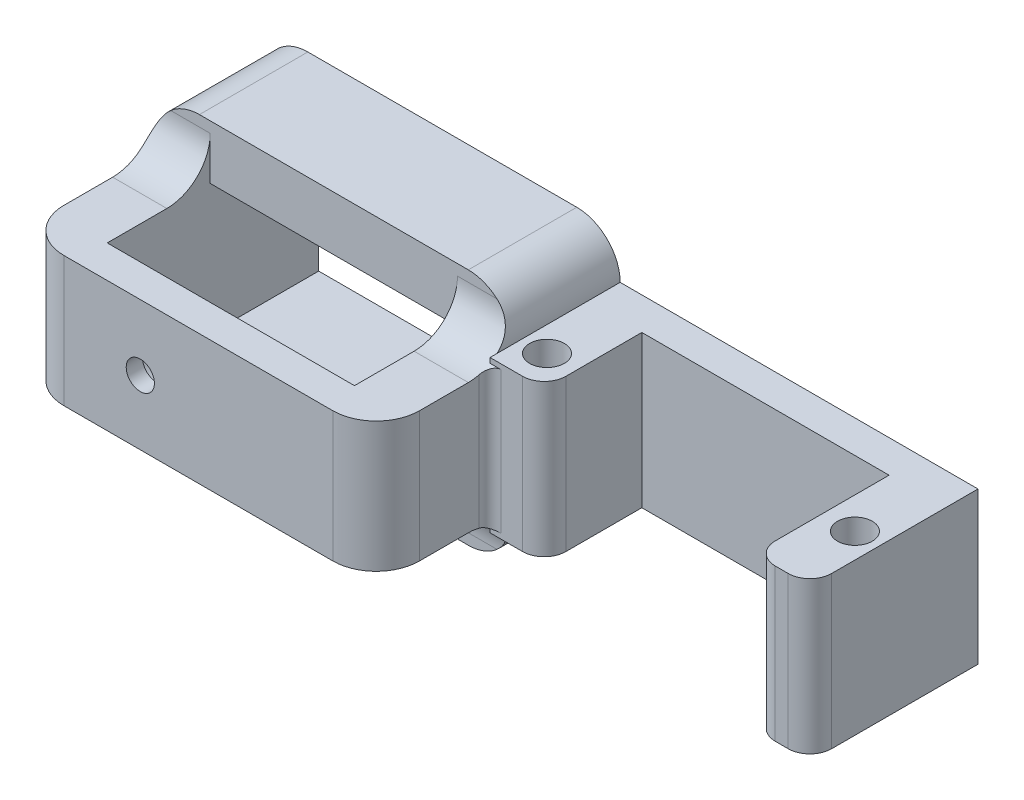
from build123d import *

# Parameters (mm, degrees)
EXTRUDE_THIN1_DEPTH = 10
FILLET1_R           = 4
SKETCH2_W           = 5
SKETCH2_H           = 12
BOSS_EXTRUDE1_DEPTH = 9.5
SKETCH3_W           = 32.8
SKETCH3_H           = 12
BOSS_EXTRUDE2_DEPTH = 3
FILLET2_R           = 4
SKETCH4_R           = 1.3
CUT_EXTRUDE1_DEPTH  = 3
SKETCH5_R           = 1.5
CUT_EXTRUDE2_DEPTH  = 6
SKETCH6_W           = 32.8
SKETCH6_H           = 10
BOSS_EXTRUDE3_DEPTH = 5
FILLET3_R           = 4
FILLET4_R           = 4
SKETCH7_R           = 2.75
CUT_EXTRUDE3_DEPTH  = 1.5
SKETCH9_W           = 9
SKETCH9_H           = 14
BOSS_EXTRUDE5_DEPTH = 5
FILLET10_R          = 1
SKETCH12_W          = 33
SKETCH12_H          = 14
BOSS_EXTRUDE7_DEPTH = 3
SKETCH13_W          = 5.2
SKETCH13_H          = 14
BOSS_EXTRUDE8_DEPTH = 12.5
FILLET11_R          = 2
FILLET13_R          = 2
SKETCH14_R          = 1.6
CUT_EXTRUDE4_DEPTH  = 58.189247273


with BuildPart() as part:
    # Sketch1 → Extrude-Thin1 (new body)
    with BuildSketch(Plane.XY):
        Polygon((-11.4, -12), (-11.4, 0), (11.4, 0), (11.4, -12), (16.4, -12), (16.4, 5), (-16.4, 5), (-16.4, -12), align=None)
    extrude(amount=EXTRUDE_THIN1_DEPTH)

    # Fillet1
    fillet1_edges = [part.edges().sort_by_distance(p)[0] for p in [
        (-16.4, 5, 5),
        (16.4, 5, 5),
    ]]
    fillet(fillet1_edges, radius=FILLET1_R)

    # Sketch2 → Boss-Extrude1 (add)
    with BuildSketch(Plane.XY.offset(10)):
        with Locations((-13.9, -6)):
            Rectangle(SKETCH2_W, SKETCH2_H)
        with Locations((13.9, -6)):
            Rectangle(SKETCH2_W, SKETCH2_H)
    extrude(amount=BOSS_EXTRUDE1_DEPTH)

    # Sketch3 → Boss-Extrude2 (add)
    with BuildSketch(Plane.XY.offset(19.5)):
        with Locations((0, -6)):
            Rectangle(SKETCH3_W, SKETCH3_H)
    extrude(amount=BOSS_EXTRUDE2_DEPTH)

    # Fillet2
    fillet2_edges = [part.edges().sort_by_distance(p)[0] for p in [
        (13.9, 0, 10),
        (-13.9, 0, 10),
        (16.4, -6, 22.5),
        (-16.4, -6, 22.5),
    ]]
    fillet(fillet2_edges, radius=FILLET2_R)

    # Sketch4 → Cut-Extrude1 (cut)
    with BuildSketch(Plane(origin=(0, 0, 19.5), x_dir=(-1, 0, 0), z_dir=(0, 0, -1))):
        with Locations((5.35, -6.05)):
            Circle(SKETCH4_R)
    extrude(amount=-CUT_EXTRUDE1_DEPTH, mode=Mode.SUBTRACT)

    # Sketch5 → Cut-Extrude2 (cut)
    with BuildSketch(Plane(origin=(0, 0, 0), x_dir=(-1, 0, 0), z_dir=(0, 0, -1))):
        with Locations((14.3, -6.05)):
            Circle(SKETCH5_R)
        with Locations((-14.1, -6.05)):
            Circle(SKETCH5_R)
    extrude(amount=-CUT_EXTRUDE2_DEPTH, mode=Mode.SUBTRACT)

    # Sketch6 → Boss-Extrude3 (add)
    with BuildSketch(Plane.XZ.offset(12)):
        with Locations((0, 5)):
            Rectangle(SKETCH6_W, SKETCH6_H)
    extrude(amount=BOSS_EXTRUDE3_DEPTH)

    # Fillet3
    fillet3_edges = [part.edges().sort_by_distance(p)[0] for p in [
        (16.4, -17, 5),
        (-16.4, -17, 5),
    ]]
    fillet(fillet3_edges, radius=FILLET3_R)

    # Fillet4
    fillet4_edges = [part.edges().sort_by_distance(p)[0] for p in [
        (13.9, -12, 10),
        (-13.9, -12, 10),
    ]]
    fillet(fillet4_edges, radius=FILLET4_R)

    # Sketch7 → Cut-Extrude3 (cut)
    with BuildSketch(Plane(origin=(0, 0, 19.5), x_dir=(-1, 0, 0), z_dir=(0, 0, -1))):
        with Locations((5.35, -6.05)):
            Circle(SKETCH7_R)
    extrude(amount=-CUT_EXTRUDE3_DEPTH, mode=Mode.SUBTRACT)

    # Sketch9 → Boss-Extrude5 (add)
    with BuildSketch(Plane(origin=(16.4, 0, 0), x_dir=(0, 0, -1), z_dir=(1, 0, 0))):
        with Locations((-7.5, -6)):
            Rectangle(SKETCH9_W, SKETCH9_H)
    extrude(amount=BOSS_EXTRUDE5_DEPTH)

    # Fillet10
    fillet10_edges = [part.edges().sort_by_distance(p)[0] for p in [
        (16.4, -6, 12),
    ]]
    fillet(fillet10_edges, radius=FILLET10_R)

    # Sketch12 → Boss-Extrude7 (add)
    with BuildSketch(Plane(origin=(0, 0, 0), x_dir=(-1, 0, 0), z_dir=(0, 0, -1))):
        with Locations((-32.9, -6)):
            Rectangle(SKETCH12_W, SKETCH12_H)
    extrude(amount=-BOSS_EXTRUDE7_DEPTH)

    # Sketch13 → Boss-Extrude8 (add)
    with BuildSketch(Plane.XY.offset(3)):
        with Locations((46.8, -6)):
            Rectangle(SKETCH13_W, SKETCH13_H)
    extrude(amount=BOSS_EXTRUDE8_DEPTH)

    # Fillet11
    fillet11_edges = [part.edges().sort_by_distance(p)[0] for p in [
        (21.4, -6, 12),
    ]]
    fillet(fillet11_edges, radius=FILLET11_R)

    # Fillet13
    fillet13_edges = [part.edges().sort_by_distance(p)[0] for p in [
        (49.4, -6, 15.5),
        (44.2, -6, 15.5),
    ]]
    fillet(fillet13_edges, radius=FILLET13_R)

    # Sketch14 → Cut-Extrude4 (cut, through all)
    with BuildSketch(Plane(origin=(0, 1, 0), x_dir=(1, 0, 0), z_dir=(0, 1, 0))):
        with Locations(Location((18.7, -9.05, 0), (0, 0, 180))):
            Circle(SKETCH14_R)
        with Locations(Location((47.1, -9.05, 0), (0, 0, 180))):
            Circle(SKETCH14_R)
    extrude(amount=-CUT_EXTRUDE4_DEPTH, mode=Mode.SUBTRACT)


solid = part.part
